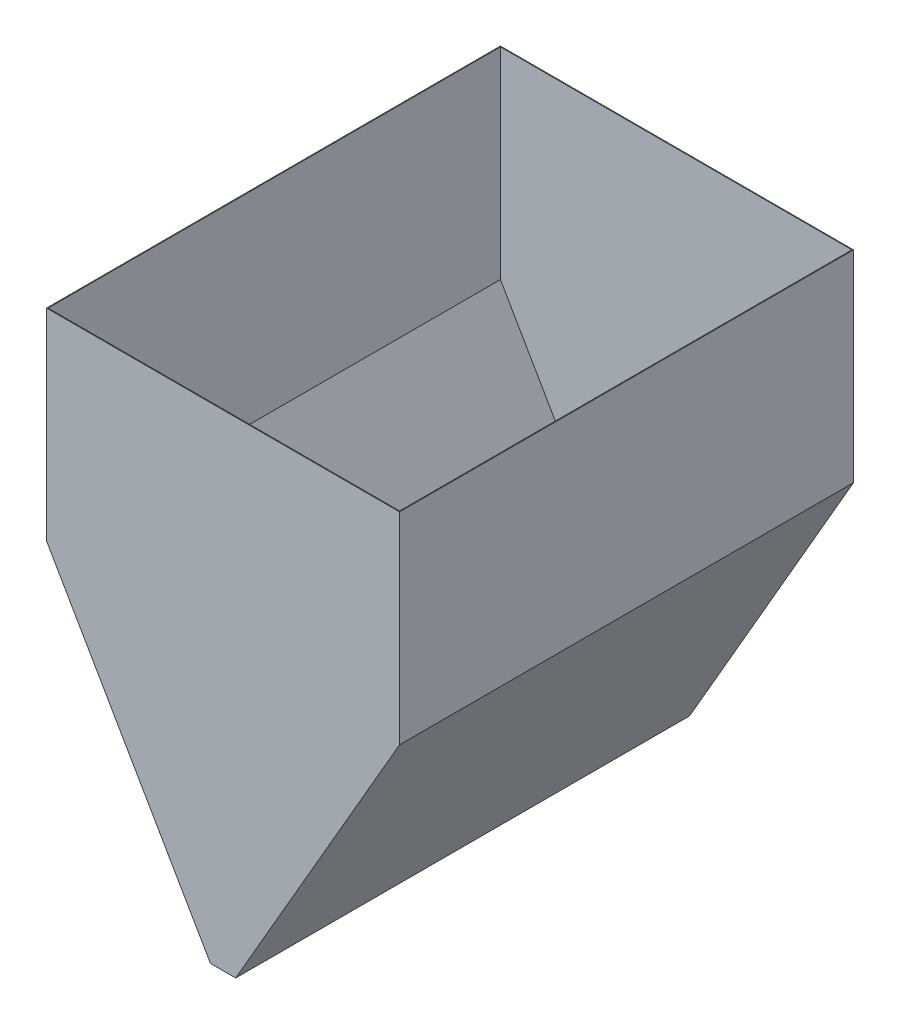
from build123d import *

# Parameters (mm, degrees)
CROQUIS3_W              = 350
CROQUIS3_H              = 450
SALIENTE_EXTRUIR1_DEPTH = 200
VACIADO2_T              = -0.76


with BuildPart() as part:
    # Croquis1 → Recubrir1 section 0
    with BuildSketch(Plane(origin=(0, 0, 0), x_dir=(1, 0, 0), z_dir=(0, 1, 0))):
        with BuildLine():
            Line((-175, 225), (175, 225))
            Line((175, 225), (175, -225))
            Line((175, -225), (-175, -225))
            Line((-175, -225), (-175, 225))
        make_face()
    # Croquis2 → Recubrir1 section 1
    with BuildSketch(Plane(origin=(0, -281.458, 0), x_dir=(1, 0, 0), z_dir=(0, 1, 0))):
        with BuildLine():
            Line((-12.5, 225), (12.5, 225))
            Line((12.5, 225), (12.5, -225))
            Line((12.5, -225), (-12.5, -225))
            Line((-12.5, -225), (-12.5, 225))
        make_face()
    loft()

    # Croquis3 → Saliente-Extruir1 (add)
    with BuildSketch(Plane(origin=(0, 0, 0), x_dir=(1, 0, 0), z_dir=(0, 1, 0))):
        Rectangle(CROQUIS3_W, CROQUIS3_H)
    extrude(amount=SALIENTE_EXTRUIR1_DEPTH)

    # Vaciado2
    vaciado2_openings = [part.faces().sort_by_distance(p)[0] for p in [
        (0, -281.458, 0),
        (0, 200, 0),
    ]]
    offset(amount=VACIADO2_T, openings=vaciado2_openings, kind=Kind.INTERSECTION)


solid = part.part
